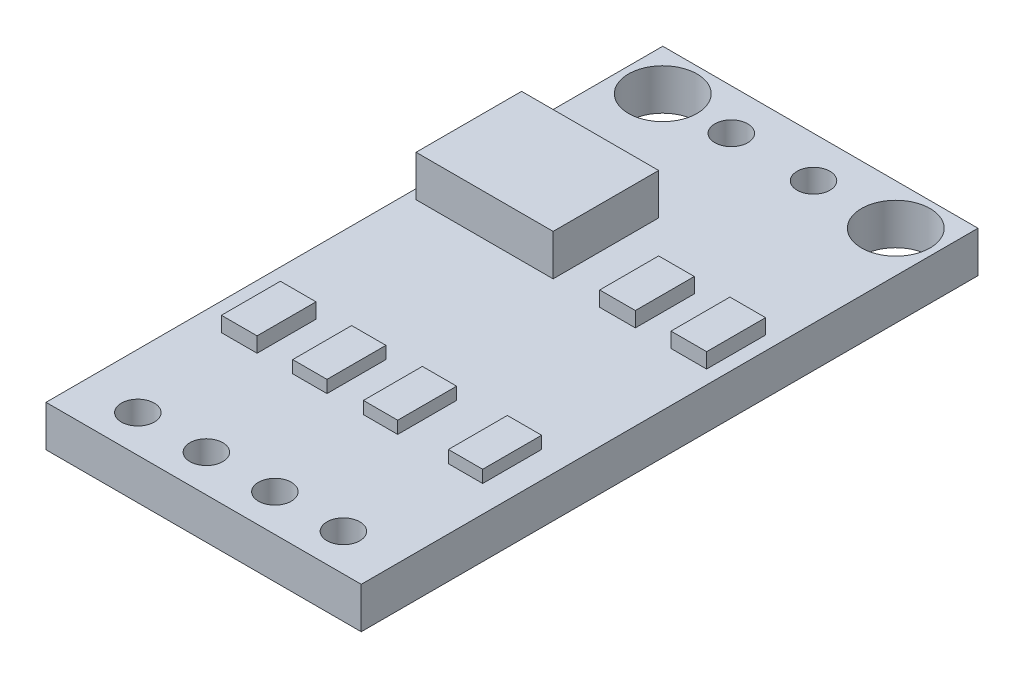
from build123d import *

# Parameters (mm, degrees)
SKETCH1_W                   = 11.5
SKETCH1_H                   = 22.5
PCB_DEPTH                   = 1.5
SKETCH2_4_R                 = 0.6
INITIAL_INPUT_HOLES_DEPTH   = 13.72301065
INPUT_HOLES_LPATTERN_COUNT  = 4
INPUT_HOLES_LPATTERN_PITCH  = 2.5
SKETCH2_3_R                 = 0.6
INITIAL_OUTPUT_HOLE_DEPTH   = 13.72301065
OUTPUT_HOLES_LPATTERN_COUNT = 2
OUTPUT_HOLES_LPATTERN_PITCH = 3
SKETCH2_R                   = 1.25
MOUNTING_HOLES_DEPTH        = 13.72301065
SKETCH3_4_W                 = 1.3
SKETCH3_4_H                 = 2.15
CAPACITORS_DEPTH            = 0.55
SKETCH3_3_W                 = 1.25
SKETCH3_3_H                 = 2.15
RESISTORS_DEPTH             = 0.45
SKETCH3_W                   = 5
SKETCH3_H                   = 3.85
TRANSCEIVER_CHIP_DEPTH      = 1.5


with BuildPart() as part:
    # Sketch1 → PCB (new body)
    with BuildSketch(Plane(origin=(0, 0, 0), x_dir=(1, 0, 0), z_dir=(0, 1, 0))):
        Rectangle(SKETCH1_W, SKETCH1_H)
    extrude(amount=PCB_DEPTH)

    # Sketch2<4> → Initial Input Holes (cut, through all)
    with BuildSketch(Plane(origin=(0, 1.5, 0), x_dir=(1, 0, 0), z_dir=(0, 1, 0))):
        with Locations((-3.75, -9.9)):
            Circle(SKETCH2_4_R)
    initial_input_holes = extrude(amount=-INITIAL_INPUT_HOLES_DEPTH, mode=Mode.SUBTRACT)

    # Input Holes LPattern: Initial Input Holes ×4
    with Locations(*[(i * INPUT_HOLES_LPATTERN_PITCH, 0, 0) for i in range(1, INPUT_HOLES_LPATTERN_COUNT)]):
        add(initial_input_holes, mode=Mode.SUBTRACT)

    # Sketch2<3> → Initial Output Hole (cut, through all)
    with BuildSketch(Plane(origin=(0, 1.5, 0), x_dir=(1, 0, 0), z_dir=(0, 1, 0))):
        with Locations((-1.75, 9.75)):
            Circle(SKETCH2_3_R)
    initial_output_hole = extrude(amount=-INITIAL_OUTPUT_HOLE_DEPTH, mode=Mode.SUBTRACT)

    # Output Holes LPattern: Initial Output Hole ×2
    with Locations(*[(i * OUTPUT_HOLES_LPATTERN_PITCH, 0, 0) for i in range(1, OUTPUT_HOLES_LPATTERN_COUNT)]):
        add(initial_output_hole, mode=Mode.SUBTRACT)

    # Sketch2 → Mounting Holes (cut, through all)
    with BuildSketch(Plane(origin=(0, 1.5, 0), x_dir=(1, 0, 0), z_dir=(0, 1, 0))):
        with Locations((-4.25, 9.75)):
            Circle(SKETCH2_R)
        with Locations((4.25, 9.75)):
            Circle(SKETCH2_R)
    extrude(amount=-MOUNTING_HOLES_DEPTH, mode=Mode.SUBTRACT)

    # Sketch3<4> → Capacitors (add)
    with BuildSketch(Plane(origin=(0, 1.5, 0), x_dir=(1, 0, 0), z_dir=(0, 1, 0))):
        with Locations((2, 2.925)):
            Rectangle(SKETCH3_4_W, SKETCH3_4_H)
        with Locations((4.6, 2.925)):
            Rectangle(SKETCH3_4_W, SKETCH3_4_H)
        with Locations((-4.1, -4.775)):
            Rectangle(SKETCH3_4_W, SKETCH3_4_H)
    extrude(amount=CAPACITORS_DEPTH)

    # Sketch3<3> → Resistors (add)
    with BuildSketch(Plane(origin=(0, 1.5, 0), x_dir=(1, 0, 0), z_dir=(0, 1, 0))):
        with Locations((4.155, -4.775)):
            Rectangle(SKETCH3_3_W, SKETCH3_3_H)
        with Locations((1.055, -4.775)):
            Rectangle(SKETCH3_3_W, SKETCH3_3_H)
        with Locations((-1.525, -4.775)):
            Rectangle(SKETCH3_3_W, SKETCH3_3_H)
    extrude(amount=RESISTORS_DEPTH)

    # Sketch3 → Transceiver Chip (add)
    with BuildSketch(Plane(origin=(0, 1.5, 0), x_dir=(1, 0, 0), z_dir=(0, 1, 0))):
        with Locations((-2.9, 3.825)):
            Rectangle(SKETCH3_W, SKETCH3_H)
    extrude(amount=TRANSCEIVER_CHIP_DEPTH)


solid = part.part
